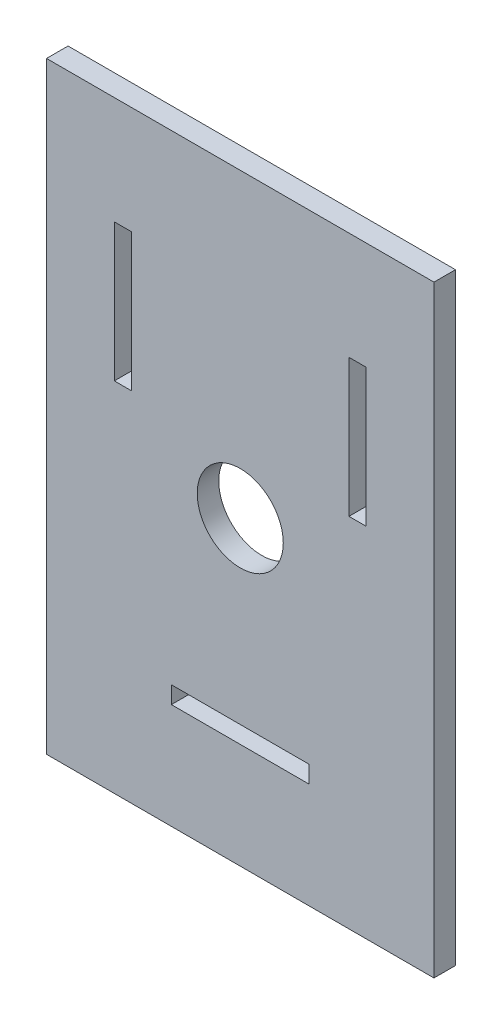
from build123d import *

# Parameters (mm, degrees)
BASES_W            = 18
BASES_H            = 28
BASE_DEPTH         = 1
NEUTRALS_W         = 0.8
NEUTRALS_H         = 6.4
NEUTRAL_DEPTH      = 1.6
SCREWACCESSS_R     = 2
SCREW_ACCESS_DEPTH = 17.673332001
GROUNDS_W          = 6.4
GROUNDS_H          = 0.8
GROUND_DEPTH       = 1.6


with BuildPart() as part:
    # BaseS → BASE (new body)
    with BuildSketch(Plane.XY):
        Rectangle(BASES_W, BASES_H)
    extrude(amount=-BASE_DEPTH)

    # NeutralS → NEUTRAL (cut)
    with BuildSketch(Plane.XY):
        with Locations((5.45, 5.8)):
            Rectangle(NEUTRALS_W, NEUTRALS_H)
    neutral = extrude(amount=-NEUTRAL_DEPTH, mode=Mode.SUBTRACT)

    # LINE HM: NEUTRAL across plane
    add(neutral.mirror(Plane(origin=(0, 0, 0), x_dir=(0, 0, 1), z_dir=(1, 0, 0))), mode=Mode.SUBTRACT)

    # ScrewAccessS → SCREW ACCESS (cut, through all)
    with BuildSketch(Plane.XY):
        Circle(SCREWACCESSS_R)
    extrude(amount=-SCREW_ACCESS_DEPTH, mode=Mode.SUBTRACT)

    # GroundS → GROUND (cut)
    with BuildSketch(Plane.XY):
        with Locations((0, -8.7)):
            Rectangle(GROUNDS_W, GROUNDS_H)
    extrude(amount=-GROUND_DEPTH, mode=Mode.SUBTRACT)


solid = part.part
